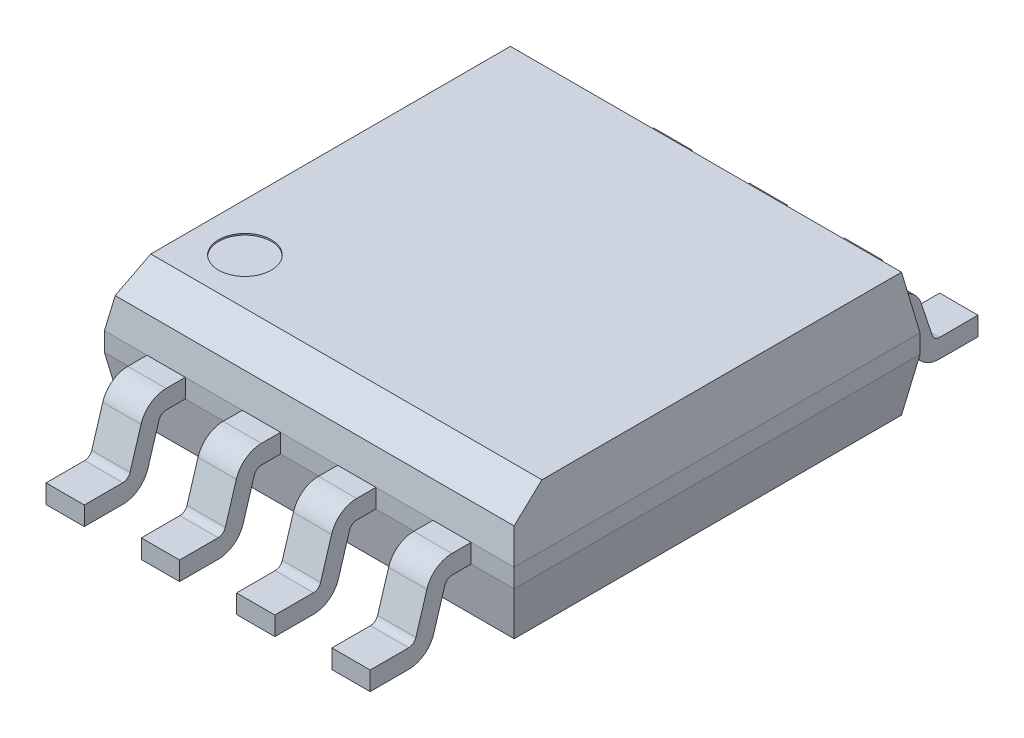
from build123d import *

# Parameters (mm, degrees)
BOSS_EXTRUDE1_DEPTH      = 0.125
BOSS_EXTRUDE1_DEPTH_BACK = 0.125
SKETCH1_W                = 5.46
SKETCH1_H                = 5.41
SKETCH2_W                = 5.46
SKETCH2_H                = 5.41
BOSS_EXTRUDE2_DEPTH      = 0.7
BOSS_EXTRUDE2_TAPER      = 10
SKETCH3_W                = 5.46
SKETCH3_H                = 5.41
BOSS_EXTRUDE3_DEPTH      = 0.7
BOSS_EXTRUDE3_TAPER      = 10
CHAMFER1_SIZE            = 0.3
CHAMFER1_SIZE2           = 0.369840916
BOSS_EXTRUDE4_START      = 0.3775
BOSS_EXTRUDE4_DEPTH      = 0.51
LPATTERN1_COUNT          = 2
LPATTERN1_PITCH          = 1.27
LPATTERN1_COL_COUNT      = 3
LPATTERN1_COL_PITCH      = 1.27
SKETCH6_R                = 0.351785146
CUT_EXTRUDE1_DEPTH       = 0.02


with BuildPart() as part:
    # Sketch1 → Boss-Extrude1 (new, two sides: drawn at the far end of the back side and taken through both)
    with BuildSketch(Plane(origin=(0, 0.92, 0), x_dir=(1, 0, 0), z_dir=(0, 1, 0)).offset(-BOSS_EXTRUDE1_DEPTH_BACK)):
        Rectangle(SKETCH1_W, SKETCH1_H)
    extrude(amount=BOSS_EXTRUDE1_DEPTH + BOSS_EXTRUDE1_DEPTH_BACK)

    # Sketch2 → Boss-Extrude2 (add)
    with BuildSketch(Plane(origin=(0, 1.045, 0), x_dir=(1, 0, 0), z_dir=(0, 1, 0))):
        Rectangle(SKETCH2_W, SKETCH2_H)
    extrude(amount=BOSS_EXTRUDE2_DEPTH, taper=BOSS_EXTRUDE2_TAPER)

    # Sketch3 → Boss-Extrude3 (add)
    with BuildSketch(Plane.XZ.offset(-0.795)):
        Rectangle(SKETCH3_W, SKETCH3_H)
    extrude(amount=BOSS_EXTRUDE3_DEPTH, taper=BOSS_EXTRUDE3_TAPER)

    # Chamfer1
    chamfer1_edges = [part.edges().sort_by_distance(p)[0] for p in [
        (0, 1.745, 2.581571114),
    ]]
    chamfer1_side = [part.faces().sort_by_distance(p)[0] for p in [
        (0, 1.392301631, 2.643761352),
    ]]
    chamfer(chamfer1_edges, length=CHAMFER1_SIZE, length2=CHAMFER1_SIZE2, reference=chamfer1_side[0])

    # Sketch5 → Boss-Extrude4 (add)
    with BuildSketch(Plane(origin=(0, 0, 0), x_dir=(0, 0, -1), z_dir=(1, 0, 0)).offset(BOSS_EXTRUDE4_START)):
        with BuildLine():
            ThreePointArc((-3.20280312, 0.243081155), (-3.329274491, 0.063778027), (-3.537635241, -0.005))
            Line((-3.537635241, -0.005), (-4.051646267, -0.005))
            Line((-4.051646267, -0.005), (-4.051646267, 0.245))
            Line((-4.051646267, 0.245), (-3.537635241, 0.245))
            ThreePointArc((-3.537635241, 0.245), (-3.478103598, 0.264650865), (-3.441968921, 0.31588033))
            Line((-3.441968921, 0.31588033), (-3.295422291, 0.796918845))
            ThreePointArc((-3.295422291, 0.796918845), (-3.168950919, 0.976221974), (-2.960590167, 1.045000002))
            Line((-2.960590167, 1.045000002), (-2.704999997, 1.045000002))
            Line((-2.704999997, 1.045000002), (-2.704999997, 0.794999999))
            Line((-2.704999997, 0.794999999), (-2.960590167, 0.794999999))
            ThreePointArc((-2.960590167, 0.794999999), (-3.020112307, 0.775356174), (-3.056249597, 0.724142296))
            Line((-3.056249597, 0.724142296), (-3.20280312, 0.243081155))
        make_face()
        with BuildLine():
            Line((2.704999997, 0.794999999), (2.960590167, 0.794999999))
            ThreePointArc((2.960590167, 0.794999999), (3.020112307, 0.775356174), (3.056249597, 0.724142296))
            Line((3.056249597, 0.724142296), (3.201156853, 0.288081155))
            ThreePointArc((3.201156853, 0.288081155), (3.327628224, 0.108778027), (3.535988974, 0.04))
            Line((3.535988974, 0.04), (4.05, 0.04))
            Line((4.05, 0.04), (4.05, 0.29))
            Line((4.05, 0.29), (3.535988974, 0.29))
            ThreePointArc((3.535988974, 0.29), (3.476457331, 0.309650865), (3.440322653, 0.36088033))
            Line((3.440322653, 0.36088033), (3.295422291, 0.796918845))
            ThreePointArc((3.295422291, 0.796918845), (3.168950919, 0.976221974), (2.960590167, 1.045000002))
            Line((2.960590167, 1.045000002), (2.704999997, 1.045000002))
            Line((2.704999997, 1.045000002), (2.704999997, 0.794999999))
        make_face()
    boss_extrude4 = extrude(amount=BOSS_EXTRUDE4_DEPTH)

    # LPattern1: Boss-Extrude4 ×2
    with Locations(*[(i * LPATTERN1_PITCH, 0, 0) for i in range(1, LPATTERN1_COUNT)]):
        add(boss_extrude4)

    # LPattern1 col: Boss-Extrude4 ×3
    with Locations(*[(-i * LPATTERN1_COL_PITCH, 0, 0) for i in range(1, LPATTERN1_COL_COUNT)]):
        add(boss_extrude4)

    # Sketch6 → Cut-Extrude1 (cut)
    with BuildSketch(Plane(origin=(0, 1.745, 0), x_dir=(1, 0, 0), z_dir=(0, 1, 0))):
        with Locations(Location((-1.967714846, -1.59473048, 0), (0, 0, 270))):
            Circle(SKETCH6_R)
    extrude(amount=-CUT_EXTRUDE1_DEPTH, mode=Mode.SUBTRACT)


solid = part.part
